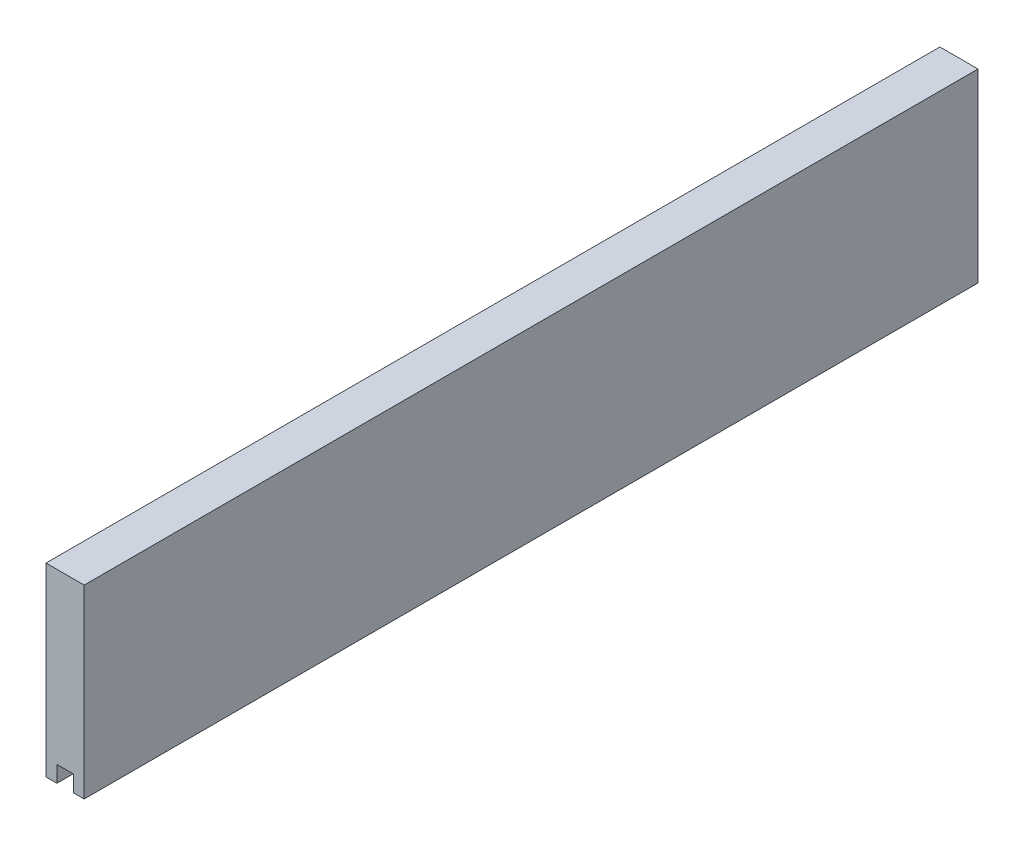
from build123d import *

# Parameters (mm, degrees)
EXTRUDE_1_DEPTH = 820


with BuildPart() as part:
    # Эскиз1 → Бобышка-Вытянуть1 (new body)
    with BuildSketch(Plane.XY):
        Polygon((0, 0), (0, 170), (35, 170), (35, 0), (25, 0), (25, 15), (10, 15), (10, 0), align=None)
    extrude(amount=-EXTRUDE_1_DEPTH)


solid = part.part
